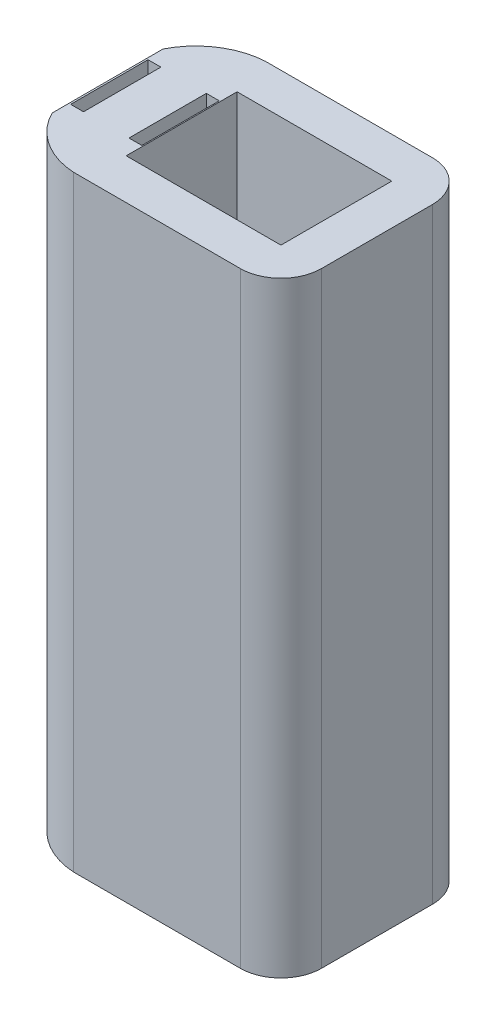
from build123d import *

# Parameters (mm, degrees)
SKETCH1_W           = 120
SKETCH1_H           = 86
SKETCH1_W_2         = 10
SKETCH1_H_2         = 60
BOSS_EXTRUDE1_DEPTH = 470


with BuildPart() as part:
    # Sketch1 → Boss-Extrude1 (new body)
    with BuildSketch(Plane(origin=(0, 0, 0), x_dir=(1, 0, 0), z_dir=(0, 1, 0))):
        with BuildLine():
            Line((60, 74.46), (-69.377570777, 74.46))
            ThreePointArc((-69.377570777, 74.46), (-97.633626185, 65.17182404), (-117.46, 43))
            Line((-117.46, 43), (-117.46, -43))
            ThreePointArc((-117.46, -43), (-97.633626185, -65.17182404), (-69.377570777, -74.46))
            Line((-69.377570777, -74.46), (60, -74.46))
            ThreePointArc((60, -74.46), (82.245579336, -65.245579336), (91.46, -43))
            Line((91.46, -43), (91.46, 43))
            ThreePointArc((91.46, 43), (82.245579336, 65.245579336), (60, 74.46))
        make_face()
        Rectangle(SKETCH1_W, SKETCH1_H, mode=Mode.SUBTRACT)
        with Locations((-65.86, 0.020423388)):
            Rectangle(SKETCH1_W_2, SKETCH1_H_2, mode=Mode.SUBTRACT)
        with Locations((-111.1, 0.020423388)):
            Rectangle(SKETCH1_W_2, SKETCH1_H_2, mode=Mode.SUBTRACT)
    extrude(amount=BOSS_EXTRUDE1_DEPTH)


solid = part.part
